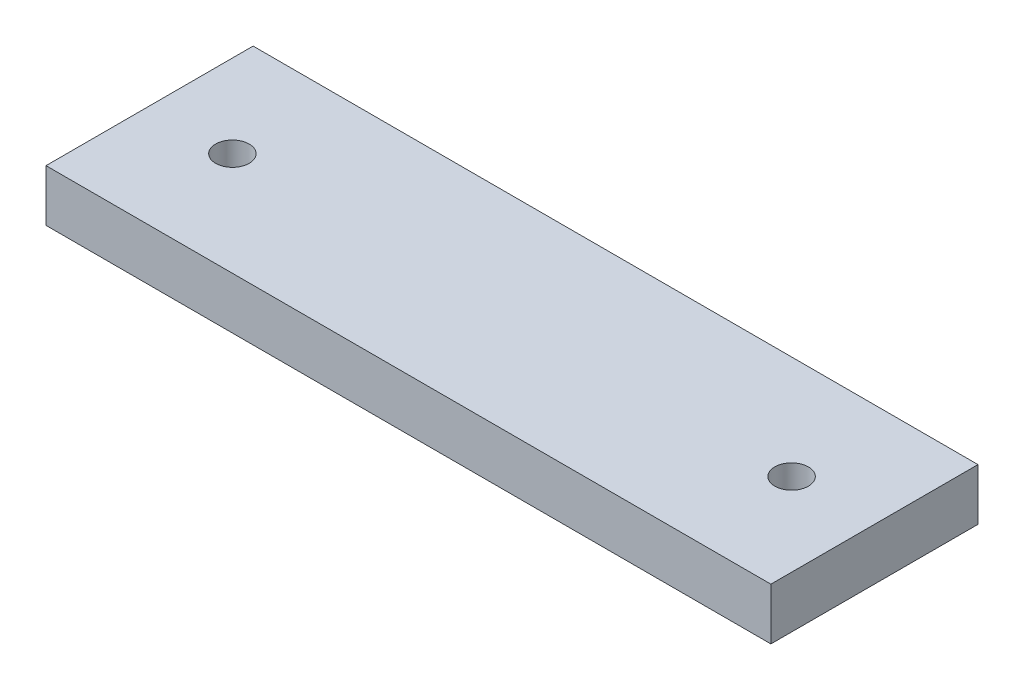
from build123d import *

# Parameters (mm, degrees)
SKETCH1_W           = 44.45
SKETCH1_H           = 12.7
SKETCH1_R           = 1.0287
BOSS_EXTRUDE1_DEPTH = 3.175


with BuildPart() as part:
    # Sketch1 → Boss-Extrude1 (new body)
    with BuildSketch(Plane(origin=(0, 0, 0), x_dir=(1, 0, 0), z_dir=(0, 1, 0))):
        Rectangle(SKETCH1_W, SKETCH1_H)
        with Locations(Location((-17.145, 0, 0), (0, 0, 270))):
            Circle(SKETCH1_R, mode=Mode.SUBTRACT)
        with Locations(Location((17.145, 0, 0), (0, 0, 90))):
            Circle(SKETCH1_R, mode=Mode.SUBTRACT)
    extrude(amount=BOSS_EXTRUDE1_DEPTH)


solid = part.part
